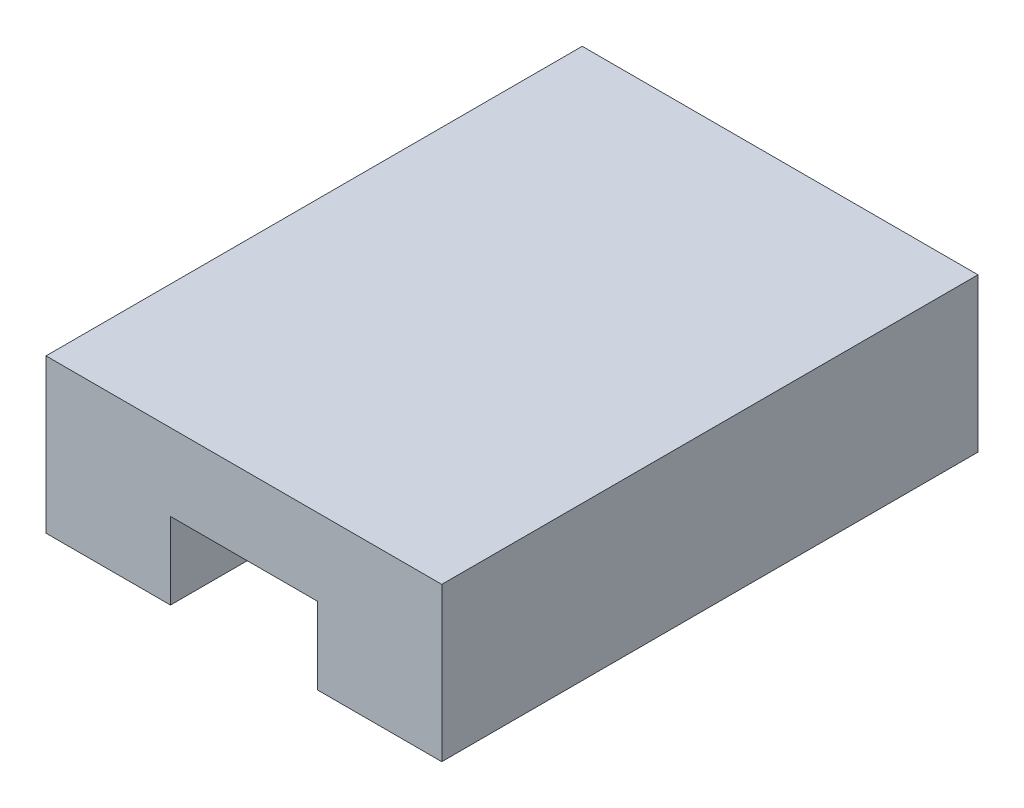
from build123d import *

# Parameters (mm, degrees)
EXTRUDE_1_DEPTH = 84


with BuildPart() as part:
    # 草图1 → 凸台-拉伸1 (new body)
    with BuildSketch(Plane.XY):
        Polygon((-25.573239437, -7.088098592), (-25.573239437, 16.971901408), (36.426760563, 16.971901408), (36.426760563, -7.088098592), (16.926760563, -7.088098592), (16.926760563, 4.941901408), (-6.073239437, 4.941901408), (-6.073239437, -7.088098592), align=None)
    extrude(amount=EXTRUDE_1_DEPTH)


solid = part.part
